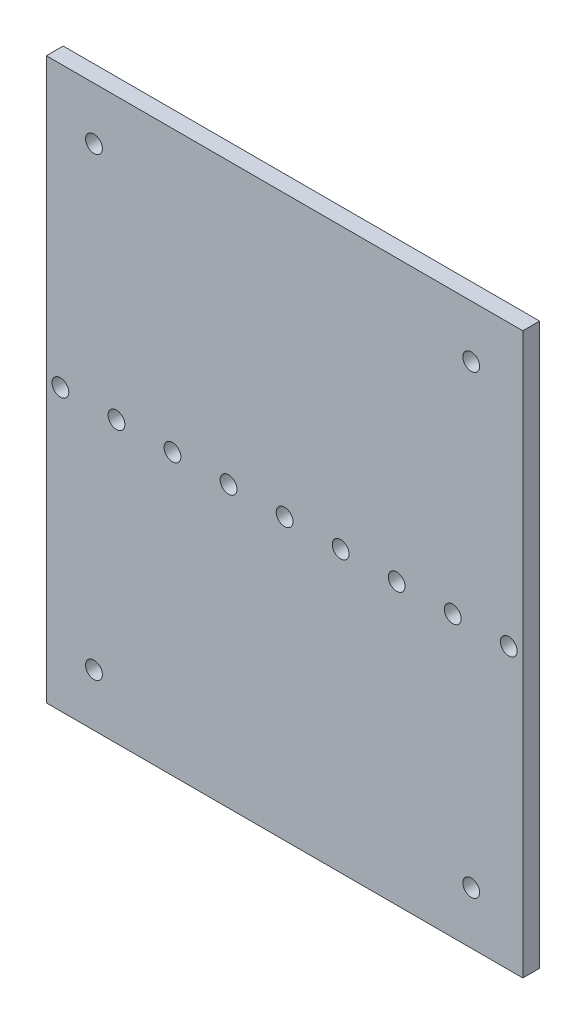
from build123d import *

# Parameters (mm, degrees)
SKETCH1_W           = 85
SKETCH1_H           = 100
BOSS_EXTRUDE1_DEPTH = 3
SKETCH2_R           = 1.5
CUT_EXTRUDE1_DEPTH  = 4
SKETCH3_R           = 1.5
CUT_EXTRUDE2_DEPTH  = 10


with BuildPart() as part:
    # Sketch1 → Boss-Extrude1 (new body)
    with BuildSketch(Plane.XY):
        with Locations((42.5, 0)):
            Rectangle(SKETCH1_W, SKETCH1_H)
    extrude(amount=BOSS_EXTRUDE1_DEPTH)

    # Sketch2 → Cut-Extrude1 (cut)
    with BuildSketch(Plane.XY.offset(3)):
        with Locations((75.8, 40.64)):
            Circle(SKETCH2_R)
        with Locations((75.8, -40.64)):
            Circle(SKETCH2_R)
        with Locations((8.49, 40.64)):
            Circle(SKETCH2_R)
        with Locations((8.49, -40.64)):
            Circle(SKETCH2_R)
    extrude(amount=-CUT_EXTRUDE1_DEPTH, mode=Mode.SUBTRACT)

    # Sketch3 → Cut-Extrude2 (cut)
    with BuildSketch(Plane.XY.offset(3)):
        with Locations((42.5, 0)):
            Circle(SKETCH3_R)
        with Locations((52.5, 0)):
            Circle(SKETCH3_R)
        with Locations((62.5, 0)):
            Circle(SKETCH3_R)
        with Locations((72.5, 0)):
            Circle(SKETCH3_R)
        with Locations((82.5, 0)):
            Circle(SKETCH3_R)
        with Locations((32.5, 0)):
            Circle(SKETCH3_R)
        with Locations((22.5, 0)):
            Circle(SKETCH3_R)
        with Locations((12.5, 0)):
            Circle(SKETCH3_R)
        with Locations((2.5, 0)):
            Circle(SKETCH3_R)
    extrude(amount=-CUT_EXTRUDE2_DEPTH, mode=Mode.SUBTRACT)


solid = part.part
